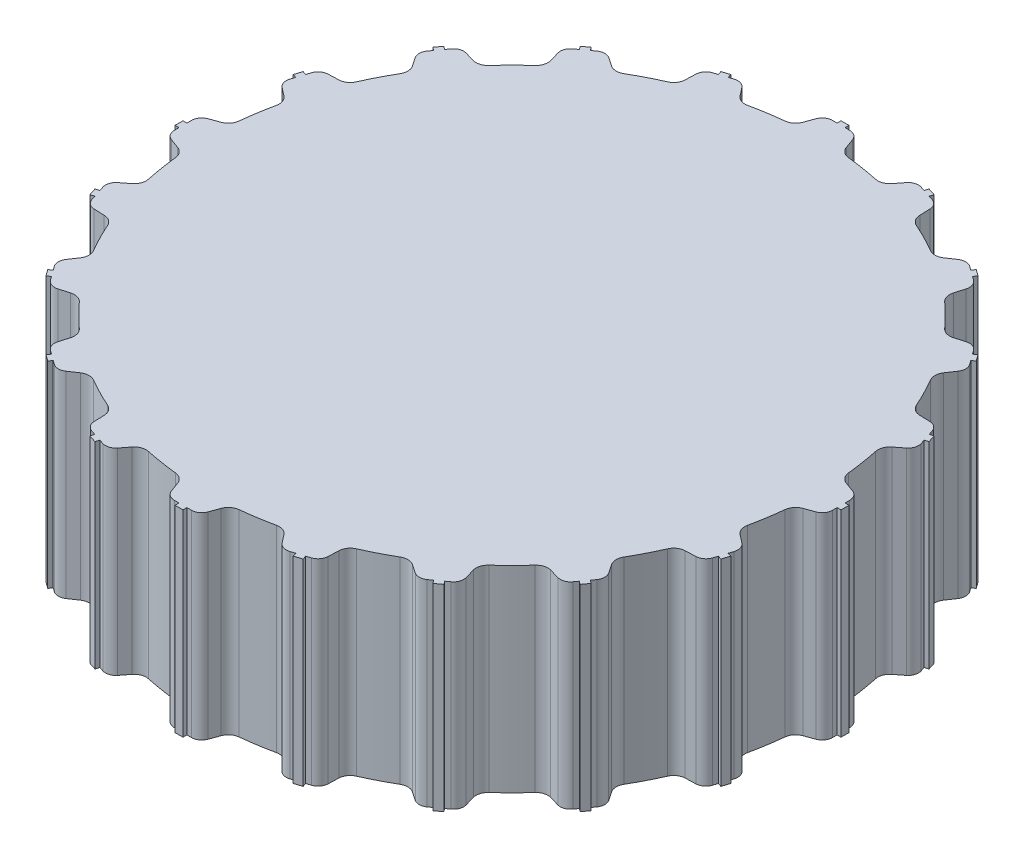
from build123d import *

# Parameters (mm, degrees)
BOSS_EXTRUDE1_DEPTH = 10


with BuildPart() as part:
    # Sketch1 → Boss-Extrude1 (new body)
    with BuildSketch(Plane(origin=(0, 0, 0), x_dir=(1, 0, 0), z_dir=(0, 1, 0))):
        with BuildLine():
            Line((-0.43589208, -16.71), (-0.2, -16.71))
            Line((-0.2, -16.71), (-0.2, -16.91))
            Line((-0.2, -16.91), (0.2, -16.91))
            Line((0.2, -16.91), (0.2, -16.71))
            Line((0.2, -16.71), (0.43589208, -16.71))
            ThreePointArc((0.43589208, -16.71), (0.734151827, -16.615959063), (0.924532243, -16.367850475))
            Line((0.924532243, -16.367850475), (1.105379955, -15.870975469))
            ThreePointArc((1.105379955, -15.870975469), (1.301966595, -15.600528843), (1.612054315, -15.475495687))
            ThreePointArc((1.612054315, -15.475495687), (2.434000061, -15.367671573), (3.249036403, -15.216223196))
            ThreePointArc((3.249036403, -15.216223196), (3.58258472, -15.239314418), (3.853122328, -15.435775831))
            Line((3.853122328, -15.435775831), (4.178661544, -15.852447026))
            ThreePointArc((4.178661544, -15.852447026), (4.436393849, -16.029581532), (4.749115973, -16.026852448))
            Line((4.749115973, -16.026852448), (4.973462673, -15.953957786))
            Line((4.973462673, -15.953957786), (5.035266072, -16.144169089))
            Line((5.035266072, -16.144169089), (5.415688678, -16.020562292))
            Line((5.415688678, -16.020562292), (5.353885279, -15.830350988))
            Line((5.353885279, -15.830350988), (5.578231979, -15.757456327))
            ThreePointArc((5.578231979, -15.757456327), (5.832833607, -15.57585075), (5.937226372, -15.281054677))
            Line((5.937226372, -15.281054677), (5.955679946, -14.752613449))
            ThreePointArc((5.955679946, -14.752613449), (6.059072348, -14.43465481), (6.315345925, -14.219918837))
            ThreePointArc((6.315345925, -14.219918837), (7.063743299, -13.863376807), (7.7920888, -13.46748076))
            ThreePointArc((7.7920888, -13.46748076), (8.116447681, -13.386369719), (8.434454152, -13.489614908))
            Line((8.434454152, -13.489614908), (8.872818824, -13.785295613))
            ThreePointArc((8.872818824, -13.785295613), (9.172674385, -13.874116877), (9.469247465, -13.774884912))
            Line((9.469247465, -13.774884912), (9.660088167, -13.636231026))
            Line((9.660088167, -13.636231026), (9.777645217, -13.798034425))
            Line((9.777645217, -13.798034425), (10.101252015, -13.562920324))
            Line((10.101252015, -13.562920324), (9.983694965, -13.401116926))
            Line((9.983694965, -13.401116926), (10.174535666, -13.26246304))
            ThreePointArc((10.174535666, -13.26246304), (10.360556994, -13.011069643), (10.368743417, -12.698442778))
            Line((10.368743417, -12.698442778), (10.222996489, -12.190162836))
            ThreePointArc((10.222996489, -12.190162836), (10.223073883, -11.855816192), (10.400447474, -11.572397255))
            ThreePointArc((10.400447474, -11.572397255), (11.002038127, -11.002038127), (11.572397255, -10.400447474))
            ThreePointArc((11.572397255, -10.400447474), (11.855816192, -10.223073883), (12.190162836, -10.222996489))
            Line((12.190162836, -10.222996489), (12.698442778, -10.368743417))
            ThreePointArc((12.698442778, -10.368743417), (13.011069643, -10.360556994), (13.26246304, -10.174535666))
            Line((13.26246304, -10.174535666), (13.401116926, -9.983694965))
            Line((13.401116926, -9.983694965), (13.562920324, -10.101252015))
            Line((13.562920324, -10.101252015), (13.798034425, -9.777645217))
            Line((13.798034425, -9.777645217), (13.636231026, -9.660088167))
            Line((13.636231026, -9.660088167), (13.774884912, -9.469247465))
            ThreePointArc((13.774884912, -9.469247465), (13.874116877, -9.172674385), (13.785295613, -8.872818824))
            Line((13.785295613, -8.872818824), (13.489614908, -8.434454152))
            ThreePointArc((13.489614908, -8.434454152), (13.386369719, -8.116447681), (13.46748076, -7.7920888))
            ThreePointArc((13.46748076, -7.7920888), (13.863376807, -7.063743299), (14.219918837, -6.315345925))
            ThreePointArc((14.219918837, -6.315345925), (14.43465481, -6.059072348), (14.752613449, -5.955679946))
            Line((14.752613449, -5.955679946), (15.281054677, -5.937226372))
            ThreePointArc((15.281054677, -5.937226372), (15.57585075, -5.832833607), (15.757456327, -5.578231979))
            Line((15.757456327, -5.578231979), (15.830350988, -5.353885279))
            Line((15.830350988, -5.353885279), (16.020562292, -5.415688678))
            Line((16.020562292, -5.415688678), (16.144169089, -5.035266072))
            Line((16.144169089, -5.035266072), (15.953957786, -4.973462673))
            Line((15.953957786, -4.973462673), (16.026852448, -4.749115973))
            ThreePointArc((16.026852448, -4.749115973), (16.029581532, -4.436393849), (15.852447026, -4.178661544))
            Line((15.852447026, -4.178661544), (15.435775831, -3.853122328))
            ThreePointArc((15.435775831, -3.853122328), (15.239314418, -3.58258472), (15.216223196, -3.249036403))
            ThreePointArc((15.216223196, -3.249036403), (15.367671573, -2.434000061), (15.475495687, -1.612054315))
            ThreePointArc((15.475495687, -1.612054315), (15.600528843, -1.301966595), (15.870975469, -1.105379955))
            Line((15.870975469, -1.105379955), (16.367850475, -0.924532243))
            ThreePointArc((16.367850475, -0.924532243), (16.615959063, -0.734151827), (16.71, -0.43589208))
            Line((16.71, -0.43589208), (16.71, -0.2))
            Line((16.71, -0.2), (16.91, -0.2))
            Line((16.91, -0.2), (16.91, 0.2))
            Line((16.91, 0.2), (16.71, 0.2))
            Line((16.71, 0.2), (16.71, 0.43589208))
            ThreePointArc((16.71, 0.43589208), (16.615959063, 0.734151827), (16.367850475, 0.924532243))
            Line((16.367850475, 0.924532243), (15.870975469, 1.105379955))
            ThreePointArc((15.870975469, 1.105379955), (15.600528843, 1.301966595), (15.475495687, 1.612054315))
            ThreePointArc((15.475495687, 1.612054315), (15.367671573, 2.434000061), (15.216223196, 3.249036403))
            ThreePointArc((15.216223196, 3.249036403), (15.239314418, 3.58258472), (15.435775831, 3.853122328))
            Line((15.435775831, 3.853122328), (15.852447026, 4.178661544))
            ThreePointArc((15.852447026, 4.178661544), (16.029581532, 4.436393849), (16.026852448, 4.749115973))
            Line((16.026852448, 4.749115973), (15.953957786, 4.973462673))
            Line((15.953957786, 4.973462673), (16.144169089, 5.035266072))
            Line((16.144169089, 5.035266072), (16.020562292, 5.415688678))
            Line((16.020562292, 5.415688678), (15.830350988, 5.353885279))
            Line((15.830350988, 5.353885279), (15.757456327, 5.578231979))
            ThreePointArc((15.757456327, 5.578231979), (15.57585075, 5.832833607), (15.281054677, 5.937226372))
            Line((15.281054677, 5.937226372), (14.752613449, 5.955679946))
            ThreePointArc((14.752613449, 5.955679946), (14.43465481, 6.059072348), (14.219918837, 6.315345925))
            ThreePointArc((14.219918837, 6.315345925), (13.863376807, 7.063743299), (13.46748076, 7.7920888))
            ThreePointArc((13.46748076, 7.7920888), (13.386369719, 8.116447681), (13.489614908, 8.434454152))
            Line((13.489614908, 8.434454152), (13.785295613, 8.872818824))
            ThreePointArc((13.785295613, 8.872818824), (13.874116877, 9.172674385), (13.774884912, 9.469247465))
            Line((13.774884912, 9.469247465), (13.636231026, 9.660088167))
            Line((13.636231026, 9.660088167), (13.798034425, 9.777645217))
            Line((13.798034425, 9.777645217), (13.562920324, 10.101252015))
            Line((13.562920324, 10.101252015), (13.401116926, 9.983694965))
            Line((13.401116926, 9.983694965), (13.26246304, 10.174535666))
            ThreePointArc((13.26246304, 10.174535666), (13.011069643, 10.360556994), (12.698442778, 10.368743417))
            Line((12.698442778, 10.368743417), (12.190162836, 10.222996489))
            ThreePointArc((12.190162836, 10.222996489), (11.855816192, 10.223073883), (11.572397255, 10.400447474))
            ThreePointArc((11.572397255, 10.400447474), (11.002038127, 11.002038127), (10.400447474, 11.572397255))
            ThreePointArc((10.400447474, 11.572397255), (10.223073883, 11.855816192), (10.222996489, 12.190162836))
            Line((10.222996489, 12.190162836), (10.368743417, 12.698442778))
            ThreePointArc((10.368743417, 12.698442778), (10.360556994, 13.011069643), (10.174535666, 13.26246304))
            Line((10.174535666, 13.26246304), (9.983694965, 13.401116926))
            Line((9.983694965, 13.401116926), (10.101252015, 13.562920324))
            Line((10.101252015, 13.562920324), (9.777645217, 13.798034425))
            Line((9.777645217, 13.798034425), (9.660088167, 13.636231026))
            Line((9.660088167, 13.636231026), (9.469247465, 13.774884912))
            ThreePointArc((9.469247465, 13.774884912), (9.172674385, 13.874116877), (8.872818824, 13.785295613))
            Line((8.872818824, 13.785295613), (8.434454152, 13.489614908))
            ThreePointArc((8.434454152, 13.489614908), (8.116447681, 13.386369719), (7.7920888, 13.46748076))
            ThreePointArc((7.7920888, 13.46748076), (7.063743299, 13.863376807), (6.315345925, 14.219918837))
            ThreePointArc((6.315345925, 14.219918837), (6.059072348, 14.43465481), (5.955679946, 14.752613449))
            Line((5.955679946, 14.752613449), (5.937226372, 15.281054677))
            ThreePointArc((5.937226372, 15.281054677), (5.832833607, 15.57585075), (5.578231979, 15.757456327))
            Line((5.578231979, 15.757456327), (5.353885279, 15.830350988))
            Line((5.353885279, 15.830350988), (5.415688678, 16.020562292))
            Line((5.415688678, 16.020562292), (5.035266072, 16.144169089))
            Line((5.035266072, 16.144169089), (4.973462673, 15.953957786))
            Line((4.973462673, 15.953957786), (4.749115973, 16.026852448))
            ThreePointArc((4.749115973, 16.026852448), (4.436393849, 16.029581532), (4.178661544, 15.852447026))
            Line((4.178661544, 15.852447026), (3.853122328, 15.435775831))
            ThreePointArc((3.853122328, 15.435775831), (3.58258472, 15.239314418), (3.249036403, 15.216223196))
            ThreePointArc((3.249036403, 15.216223196), (2.434000061, 15.367671573), (1.612054315, 15.475495687))
            ThreePointArc((1.612054315, 15.475495687), (1.301966595, 15.600528843), (1.105379955, 15.870975469))
            Line((1.105379955, 15.870975469), (0.924532243, 16.367850475))
            ThreePointArc((0.924532243, 16.367850475), (0.734151827, 16.615959063), (0.43589208, 16.71))
            Line((0.43589208, 16.71), (0.2, 16.71))
            Line((0.2, 16.71), (0.2, 16.91))
            Line((0.2, 16.91), (-0.2, 16.91))
            Line((-0.2, 16.91), (-0.2, 16.71))
            Line((-0.2, 16.71), (-0.43589208, 16.71))
            ThreePointArc((-0.43589208, 16.71), (-0.734151827, 16.615959063), (-0.924532243, 16.367850475))
            Line((-0.924532243, 16.367850475), (-1.105379955, 15.870975469))
            ThreePointArc((-1.105379955, 15.870975469), (-1.301966595, 15.600528843), (-1.612054315, 15.475495687))
            ThreePointArc((-1.612054315, 15.475495687), (-2.434000061, 15.367671573), (-3.249036403, 15.216223196))
            ThreePointArc((-3.249036403, 15.216223196), (-3.58258472, 15.239314418), (-3.853122328, 15.435775831))
            Line((-3.853122328, 15.435775831), (-4.178661544, 15.852447026))
            ThreePointArc((-4.178661544, 15.852447026), (-4.436393849, 16.029581532), (-4.749115973, 16.026852448))
            Line((-4.749115973, 16.026852448), (-4.973462673, 15.953957786))
            Line((-4.973462673, 15.953957786), (-5.035266072, 16.144169089))
            Line((-5.035266072, 16.144169089), (-5.415688678, 16.020562292))
            Line((-5.415688678, 16.020562292), (-5.353885279, 15.830350988))
            Line((-5.353885279, 15.830350988), (-5.578231979, 15.757456327))
            ThreePointArc((-5.578231979, 15.757456327), (-5.832833607, 15.57585075), (-5.937226372, 15.281054677))
            Line((-5.937226372, 15.281054677), (-5.955679946, 14.752613449))
            ThreePointArc((-5.955679946, 14.752613449), (-6.059072348, 14.43465481), (-6.315345925, 14.219918837))
            ThreePointArc((-6.315345925, 14.219918837), (-7.063743299, 13.863376807), (-7.7920888, 13.46748076))
            ThreePointArc((-7.7920888, 13.46748076), (-8.116447681, 13.386369719), (-8.434454152, 13.489614908))
            Line((-8.434454152, 13.489614908), (-8.872818824, 13.785295613))
            ThreePointArc((-8.872818824, 13.785295613), (-9.172674385, 13.874116877), (-9.469247465, 13.774884912))
            Line((-9.469247465, 13.774884912), (-9.660088167, 13.636231026))
            Line((-9.660088167, 13.636231026), (-9.777645217, 13.798034425))
            Line((-9.777645217, 13.798034425), (-10.101252015, 13.562920324))
            Line((-10.101252015, 13.562920324), (-9.983694965, 13.401116926))
            Line((-9.983694965, 13.401116926), (-10.174535666, 13.26246304))
            ThreePointArc((-10.174535666, 13.26246304), (-10.360556994, 13.011069643), (-10.368743417, 12.698442778))
            Line((-10.368743417, 12.698442778), (-10.222996489, 12.190162836))
            ThreePointArc((-10.222996489, 12.190162836), (-10.223073883, 11.855816192), (-10.400447474, 11.572397255))
            ThreePointArc((-10.400447474, 11.572397255), (-11.002038127, 11.002038127), (-11.572397255, 10.400447474))
            ThreePointArc((-11.572397255, 10.400447474), (-11.855816192, 10.223073883), (-12.190162836, 10.222996489))
            Line((-12.190162836, 10.222996489), (-12.698442778, 10.368743417))
            ThreePointArc((-12.698442778, 10.368743417), (-13.011069643, 10.360556994), (-13.26246304, 10.174535666))
            Line((-13.26246304, 10.174535666), (-13.401116926, 9.983694965))
            Line((-13.401116926, 9.983694965), (-13.562920324, 10.101252015))
            Line((-13.562920324, 10.101252015), (-13.798034425, 9.777645217))
            Line((-13.798034425, 9.777645217), (-13.636231026, 9.660088167))
            Line((-13.636231026, 9.660088167), (-13.774884912, 9.469247465))
            ThreePointArc((-13.774884912, 9.469247465), (-13.874116877, 9.172674385), (-13.785295613, 8.872818824))
            Line((-13.785295613, 8.872818824), (-13.489614908, 8.434454152))
            ThreePointArc((-13.489614908, 8.434454152), (-13.386369719, 8.116447681), (-13.46748076, 7.7920888))
            ThreePointArc((-13.46748076, 7.7920888), (-13.863376807, 7.063743299), (-14.219918837, 6.315345925))
            ThreePointArc((-14.219918837, 6.315345925), (-14.43465481, 6.059072348), (-14.752613449, 5.955679946))
            Line((-14.752613449, 5.955679946), (-15.281054677, 5.937226372))
            ThreePointArc((-15.281054677, 5.937226372), (-15.57585075, 5.832833607), (-15.757456327, 5.578231979))
            Line((-15.757456327, 5.578231979), (-15.830350988, 5.353885279))
            Line((-15.830350988, 5.353885279), (-16.020562292, 5.415688678))
            Line((-16.020562292, 5.415688678), (-16.144169089, 5.035266072))
            Line((-16.144169089, 5.035266072), (-15.953957786, 4.973462673))
            Line((-15.953957786, 4.973462673), (-16.026852448, 4.749115973))
            ThreePointArc((-16.026852448, 4.749115973), (-16.029581532, 4.436393849), (-15.852447026, 4.178661544))
            Line((-15.852447026, 4.178661544), (-15.435775831, 3.853122328))
            ThreePointArc((-15.435775831, 3.853122328), (-15.239314418, 3.58258472), (-15.216223196, 3.249036403))
            ThreePointArc((-15.216223196, 3.249036403), (-15.367671573, 2.434000061), (-15.475495687, 1.612054315))
            ThreePointArc((-15.475495687, 1.612054315), (-15.600528843, 1.301966595), (-15.870975469, 1.105379955))
            Line((-15.870975469, 1.105379955), (-16.367850475, 0.924532243))
            ThreePointArc((-16.367850475, 0.924532243), (-16.615959063, 0.734151827), (-16.71, 0.43589208))
            Line((-16.71, 0.43589208), (-16.71, 0.2))
            Line((-16.71, 0.2), (-16.91, 0.2))
            Line((-16.91, 0.2), (-16.91, -0.2))
            Line((-16.91, -0.2), (-16.71, -0.2))
            Line((-16.71, -0.2), (-16.71, -0.43589208))
            ThreePointArc((-16.71, -0.43589208), (-16.615959063, -0.734151827), (-16.367850475, -0.924532243))
            Line((-16.367850475, -0.924532243), (-15.870975469, -1.105379955))
            ThreePointArc((-15.870975469, -1.105379955), (-15.600528843, -1.301966595), (-15.475495687, -1.612054315))
            ThreePointArc((-15.475495687, -1.612054315), (-15.367671573, -2.434000061), (-15.216223196, -3.249036403))
            ThreePointArc((-15.216223196, -3.249036403), (-15.239314418, -3.58258472), (-15.435775831, -3.853122328))
            Line((-15.435775831, -3.853122328), (-15.852447026, -4.178661544))
            ThreePointArc((-15.852447026, -4.178661544), (-16.029581532, -4.436393849), (-16.026852448, -4.749115973))
            Line((-16.026852448, -4.749115973), (-15.953957786, -4.973462673))
            Line((-15.953957786, -4.973462673), (-16.144169089, -5.035266072))
            Line((-16.144169089, -5.035266072), (-16.020562292, -5.415688678))
            Line((-16.020562292, -5.415688678), (-15.830350988, -5.353885279))
            Line((-15.830350988, -5.353885279), (-15.757456327, -5.578231979))
            ThreePointArc((-15.757456327, -5.578231979), (-15.57585075, -5.832833607), (-15.281054677, -5.937226372))
            Line((-15.281054677, -5.937226372), (-14.752613449, -5.955679946))
            ThreePointArc((-14.752613449, -5.955679946), (-14.43465481, -6.059072348), (-14.219918837, -6.315345925))
            ThreePointArc((-14.219918837, -6.315345925), (-13.863376807, -7.063743299), (-13.46748076, -7.7920888))
            ThreePointArc((-13.46748076, -7.7920888), (-13.386369719, -8.116447681), (-13.489614908, -8.434454152))
            Line((-13.489614908, -8.434454152), (-13.785295613, -8.872818824))
            ThreePointArc((-13.785295613, -8.872818824), (-13.874116877, -9.172674385), (-13.774884912, -9.469247465))
            Line((-13.774884912, -9.469247465), (-13.636231026, -9.660088167))
            Line((-13.636231026, -9.660088167), (-13.798034425, -9.777645217))
            Line((-13.798034425, -9.777645217), (-13.562920324, -10.101252015))
            Line((-13.562920324, -10.101252015), (-13.401116926, -9.983694965))
            Line((-13.401116926, -9.983694965), (-13.26246304, -10.174535666))
            ThreePointArc((-13.26246304, -10.174535666), (-13.011069643, -10.360556994), (-12.698442778, -10.368743417))
            Line((-12.698442778, -10.368743417), (-12.190162836, -10.222996489))
            ThreePointArc((-12.190162836, -10.222996489), (-11.855816192, -10.223073883), (-11.572397255, -10.400447474))
            ThreePointArc((-11.572397255, -10.400447474), (-11.002038127, -11.002038127), (-10.400447474, -11.572397255))
            ThreePointArc((-10.400447474, -11.572397255), (-10.223073883, -11.855816192), (-10.222996489, -12.190162836))
            Line((-10.222996489, -12.190162836), (-10.368743417, -12.698442778))
            ThreePointArc((-10.368743417, -12.698442778), (-10.360556994, -13.011069643), (-10.174535666, -13.26246304))
            Line((-10.174535666, -13.26246304), (-9.983694965, -13.401116926))
            Line((-9.983694965, -13.401116926), (-10.101252015, -13.562920324))
            Line((-10.101252015, -13.562920324), (-9.777645217, -13.798034425))
            Line((-9.777645217, -13.798034425), (-9.660088167, -13.636231026))
            Line((-9.660088167, -13.636231026), (-9.469247465, -13.774884912))
            ThreePointArc((-9.469247465, -13.774884912), (-9.172674385, -13.874116877), (-8.872818824, -13.785295613))
            Line((-8.872818824, -13.785295613), (-8.434454152, -13.489614908))
            ThreePointArc((-8.434454152, -13.489614908), (-8.116447681, -13.386369719), (-7.7920888, -13.46748076))
            ThreePointArc((-7.7920888, -13.46748076), (-7.063743299, -13.863376807), (-6.315345925, -14.219918837))
            ThreePointArc((-6.315345925, -14.219918837), (-6.059072348, -14.43465481), (-5.955679946, -14.752613449))
            Line((-5.955679946, -14.752613449), (-5.937226372, -15.281054677))
            ThreePointArc((-5.937226372, -15.281054677), (-5.832833607, -15.57585075), (-5.578231979, -15.757456327))
            Line((-5.578231979, -15.757456327), (-5.353885279, -15.830350988))
            Line((-5.353885279, -15.830350988), (-5.415688678, -16.020562292))
            Line((-5.415688678, -16.020562292), (-5.035266072, -16.144169089))
            Line((-5.035266072, -16.144169089), (-4.973462673, -15.953957786))
            Line((-4.973462673, -15.953957786), (-4.749115973, -16.026852448))
            ThreePointArc((-4.749115973, -16.026852448), (-4.436393849, -16.029581532), (-4.178661544, -15.852447026))
            Line((-4.178661544, -15.852447026), (-3.853122328, -15.435775831))
            ThreePointArc((-3.853122328, -15.435775831), (-3.58258472, -15.239314418), (-3.249036403, -15.216223196))
            ThreePointArc((-3.249036403, -15.216223196), (-2.434000061, -15.367671573), (-1.612054315, -15.475495687))
            ThreePointArc((-1.612054315, -15.475495687), (-1.301966595, -15.600528843), (-1.105379955, -15.870975469))
            Line((-1.105379955, -15.870975469), (-0.924532243, -16.367850475))
            ThreePointArc((-0.924532243, -16.367850475), (-0.734151827, -16.615959063), (-0.43589208, -16.71))
        make_face()
    extrude(amount=BOSS_EXTRUDE1_DEPTH)


solid = part.part
